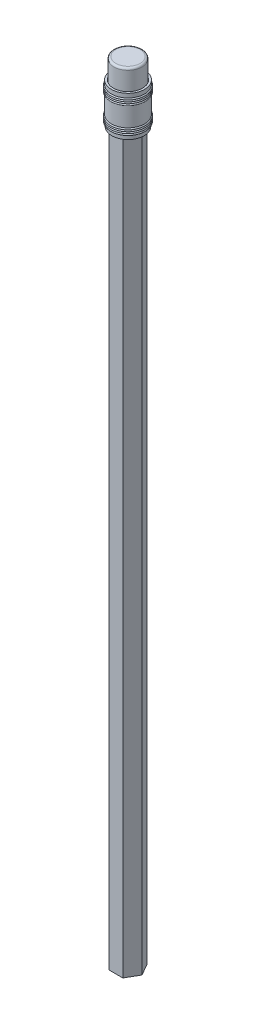
from build123d import *

# Parameters (mm, degrees)
SKETCH1_R           = 1.25
LEAD_DEPTH          = 185
SKETCH2_R           = 1.25
WOODEN_CASING_DEPTH = 185
SKETCH3_R           = 3.5
ERASER_DEPTH        = 10
FILLET_2_R          = 0.5


with BuildPart() as part:
    # Sketch1 → Lead (new body)
    with BuildSketch(Plane(origin=(0, 0, 0), x_dir=(1, 0, 0), z_dir=(0, 1, 0))):
        with Locations(Location((0, 0, 0), (0, 0, 270))):
            Circle(SKETCH1_R)
    extrude(amount=LEAD_DEPTH)


with BuildPart() as body_2:
    # Sketch2 → Wooden Casing (new body)
    with BuildSketch(Plane.XZ):
        Polygon((-3.464101615, 0), (-1.732050808, -3), (1.732050808, -3), (3.464101615, 0), (1.732050808, 3), (-1.732050808, 3), align=None)
        with Locations(Location((0, 0, 0), (0, 0, 270))):
            Circle(SKETCH2_R, mode=Mode.SUBTRACT)
    extrude(amount=-WOODEN_CASING_DEPTH)


with BuildPart() as body_3:
    # Sketch3 → Eraser (new body)
    with BuildSketch(Plane(origin=(0, 185, 0), x_dir=(1, 0, 0), z_dir=(0, 1, 0))):
        with Locations(Location((0, 0, 0), (0, 0, 270))):
            Circle(SKETCH3_R)
    extrude(amount=ERASER_DEPTH)

    # Fillet 2
    fillet_2_edges = [body_3.edges().sort_by_distance(p)[0] for p in [
        (0, 195, -3.5),
    ]]
    fillet(fillet_2_edges, radius=FILLET_2_R)


with BuildPart() as body_4:
    # Sketch4 → Revolve6 (revolve)
    with BuildSketch(Plane.XY):
        with BuildLine():
            Line((-3.6, 181), (-3.6, 180.000593557))
            Line((-3.6, 180.000593557), (-3.991046812, 180.000593557))
            Line((-3.991046812, 180.000593557), (-3.991046812, 181.027919528))
            ThreePointArc((-3.991046812, 181.027919528), (-4.291759649, 181.138819578), (-4.1, 181.395637156))
            ThreePointArc((-4.1, 181.395637156), (-4.3, 181.595637156), (-4.1, 181.795637156))
            ThreePointArc((-4.1, 181.795637156), (-4.3, 181.995637156), (-4.1, 182.195637156))
            ThreePointArc((-4.1, 182.195637156), (-4.3, 182.395637156), (-4.1, 182.595637156))
            Line((-4.1, 182.595637156), (-4.1, 184.995637156))
            Line((-4.1, 184.995637156), (-4.1, 187.395637156))
            ThreePointArc((-4.1, 187.395637156), (-4.3, 187.595637156), (-4.1, 187.795637156))
            ThreePointArc((-4.1, 187.795637156), (-4.3, 187.995637156), (-4.1, 188.195637156))
            ThreePointArc((-4.1, 188.195637156), (-4.3, 188.395637156), (-4.1, 188.595637156))
            ThreePointArc((-4.1, 188.595637156), (-4.3, 188.795637156), (-4.1, 188.995637156))
            Line((-4.1, 188.995637156), (-4.1, 190))
            Line((-4.1, 190), (-3.6, 190))
            Line((-3.6, 190), (-3.6, 189))
            ThreePointArc((-3.6, 189), (-3.4, 188.8), (-3.6, 188.6))
            ThreePointArc((-3.6, 188.6), (-3.4, 188.4), (-3.6, 188.2))
            ThreePointArc((-3.6, 188.2), (-3.4, 188), (-3.6, 187.8))
            ThreePointArc((-3.6, 187.8), (-3.4, 187.6), (-3.6, 187.4))
            Line((-3.6, 187.4), (-3.6, 182.6))
            ThreePointArc((-3.6, 182.6), (-3.4, 182.4), (-3.6, 182.2))
            ThreePointArc((-3.6, 182.2), (-3.4, 182), (-3.6, 181.8))
            ThreePointArc((-3.6, 181.8), (-3.4, 181.6), (-3.6, 181.4))
            ThreePointArc((-3.6, 181.4), (-3.4, 181.2), (-3.6, 181))
        make_face()
    revolve(axis=Axis((0, 195, 0), (0, -1, 0)))


solid = Compound([part.part, body_2.part, body_3.part, body_4.part])
